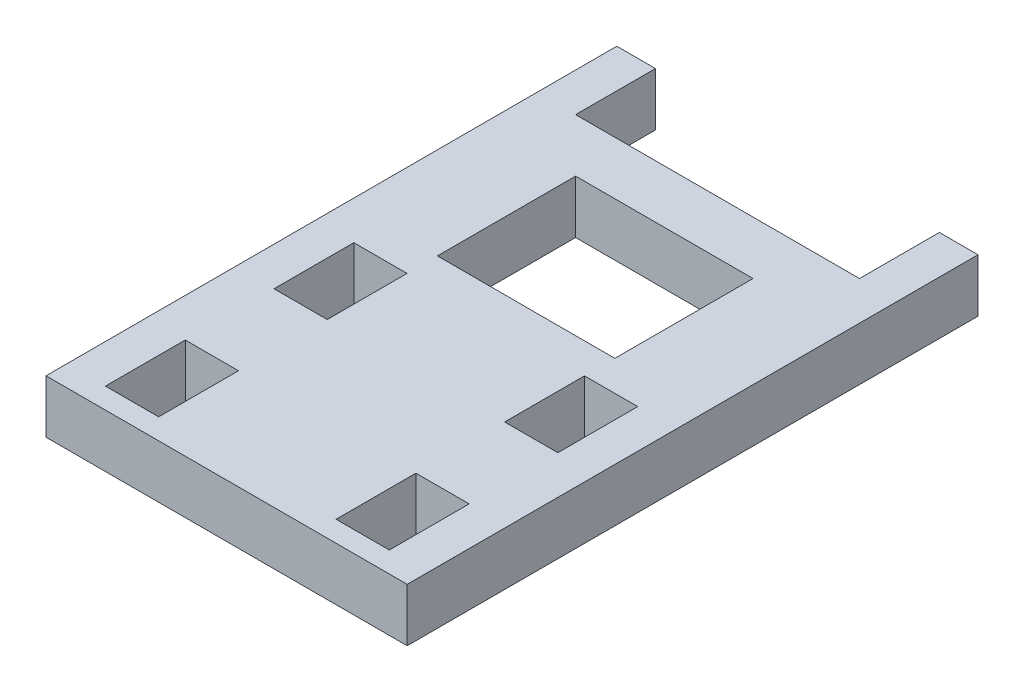
from build123d import *

# Parameters (mm, degrees)
SKETCH1_W           = 6
SKETCH1_H           = 9
SKETCH1_W_2         = 20
SKETCH1_H_2         = 15.579203612
BOSS_EXTRUDE1_DEPTH = 6


with BuildPart() as part:
    # Sketch1 → Boss-Extrude1 (new body)
    with BuildSketch(Plane(origin=(0, 0, 0), x_dir=(1, 0, 0), z_dir=(0, 1, 0))):
        Polygon((-27.97781142, 17.579932433), (-27.97781142, -16.909955783), (12.733891313, -16.909955783), (12.733891313, 17.579932433), (12.733891313, 38.430995495), (12.733891313, 47.430995495), (8.378039947, 47.430995495), (8.378039947, 38.430995495), (-23.621960053, 38.430995495), (-23.621960053, 47.430995495), (-27.97781142, 47.430995495), (-27.97781142, 38.430995495), align=None)
        with Locations((5.378039947, 8.930995495)):
            Rectangle(SKETCH1_W, SKETCH1_H, mode=Mode.SUBTRACT)
        with Locations((5.378039947, -10.069004505)):
            Rectangle(SKETCH1_W, SKETCH1_H, mode=Mode.SUBTRACT)
        with Locations((-20.621960053, 8.930995495)):
            Rectangle(SKETCH1_W, SKETCH1_H, mode=Mode.SUBTRACT)
        with Locations((-20.621960053, -10.069004505)):
            Rectangle(SKETCH1_W, SKETCH1_H, mode=Mode.SUBTRACT)
        with Locations((-7.621960053, 24.641393689)):
            Rectangle(SKETCH1_W_2, SKETCH1_H_2, mode=Mode.SUBTRACT)
    extrude(amount=BOSS_EXTRUDE1_DEPTH)


solid = part.part
